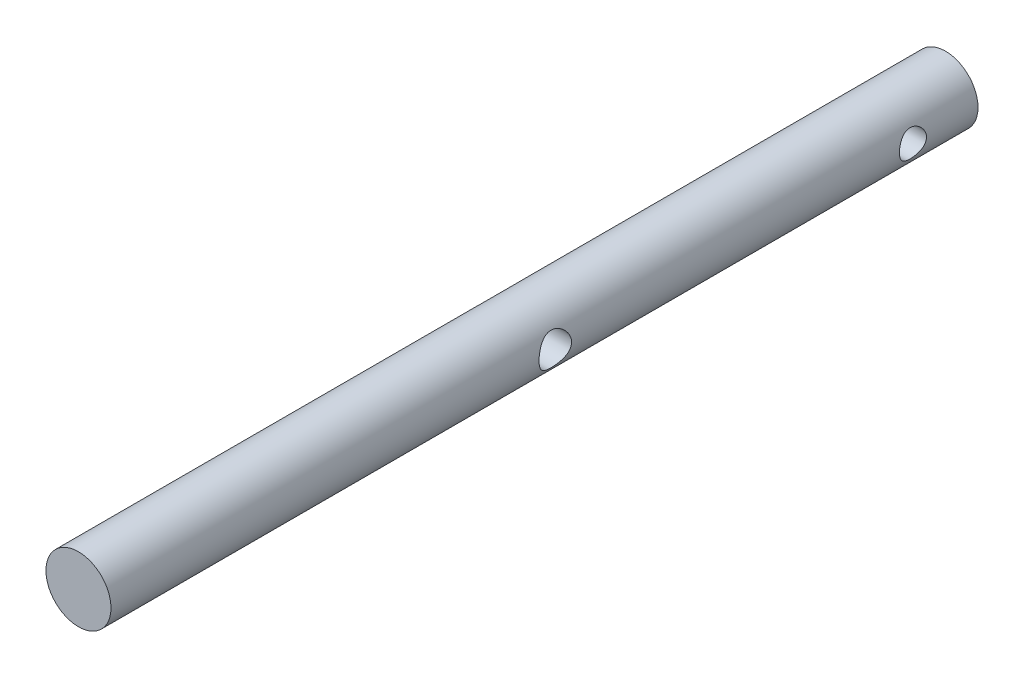
from build123d import *

# Parameters (mm, degrees)
ESQUISSE1_R                  = 3
BOSS_EXTRU_1_DEPTH           = 80
ENL_V_MAT_EXTRU_1_DEPTH      = 81.112421009
ENL_V_MAT_EXTRU_1_DEPTH_BACK = 81.112421009
ESQUISSE2_R                  = 1.25
ESQUISSE2_R_2                = 1.5
ENL_V_START                  = -3
ESQUISSE3_R                  = 3
ENL_V_MAT_EXTRU_2_DEPTH      = 1


with BuildPart() as part:
    # Esquisse1 → Boss.-Extru.1 (new body)
    with BuildSketch(Plane.XY):
        Circle(ESQUISSE1_R)
    extrude(amount=BOSS_EXTRU_1_DEPTH)

    # Esquisse2 → Enlèv. mat.-Extru.1 (cut, two sides: drawn at the far end of the back side and taken through both)
    with BuildSketch(Plane(origin=(0, 0, 0), x_dir=(0, 0, -1), z_dir=(1, 0, 0)).offset(-ENL_V_MAT_EXTRU_1_DEPTH_BACK)):
        with Locations(Location((-6, 0, 0), (0, 0, 180.000000002))):
            Circle(ESQUISSE2_R)
        with Locations(Location((-39, 0, 0), (0, 0, 179.999999999))):
            Circle(ESQUISSE2_R_2)
    extrude(amount=ENL_V_MAT_EXTRU_1_DEPTH + ENL_V_MAT_EXTRU_1_DEPTH_BACK, mode=Mode.SUBTRACT)

    # Esquisse3 → Enlèv. mat.-Extru.2 (cut, symmetric)
    with BuildSketch(Plane(origin=(0, 0, 0), x_dir=(0, 0, -1), z_dir=(1, 0, 0)).offset(ENL_V_START)):
        with Locations((-39, 0)):
            Circle(ESQUISSE3_R)
    extrude(amount=ENL_V_MAT_EXTRU_2_DEPTH, both=True, mode=Mode.SUBTRACT)


solid = part.part
